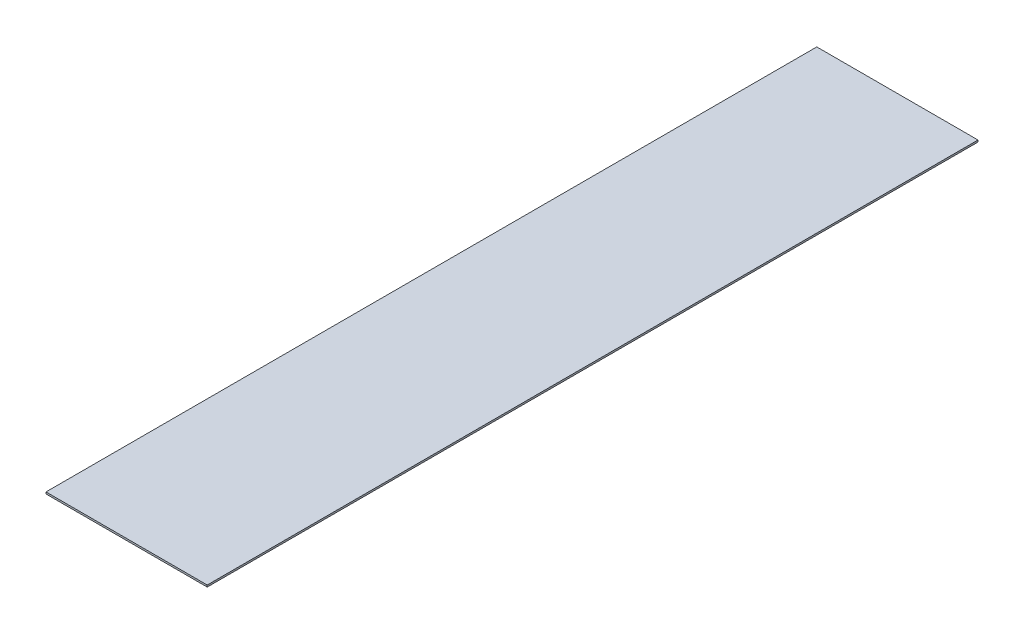
from build123d import *

# Parameters (mm, degrees)
SKETCH1_W           = 88.9
SKETCH1_H           = 425
BOSS_EXTRUDE1_DEPTH = 1


with BuildPart() as part:
    # Sketch1 → Boss-Extrude1 (new body)
    with BuildSketch(Plane(origin=(0, 0, 0), x_dir=(1, 0, 0), z_dir=(0, 1, 0))):
        Rectangle(SKETCH1_W, SKETCH1_H)
    extrude(amount=BOSS_EXTRUDE1_DEPTH)


solid = part.part
